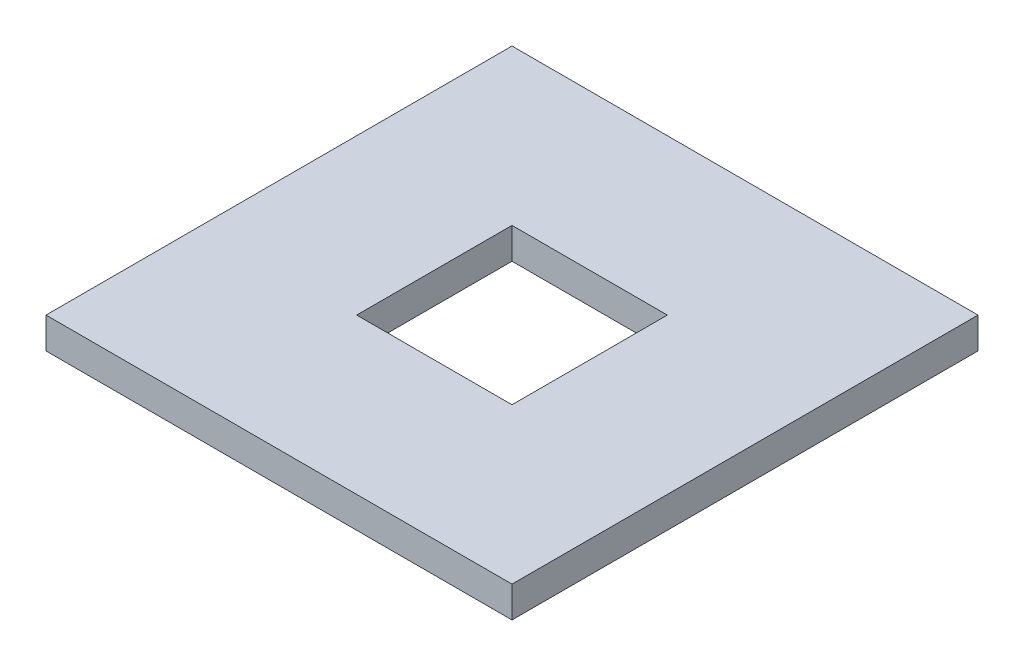
from build123d import *

# Parameters (mm, degrees)
SKETCH1_W           = 1500
SKETCH1_H           = 1500
SKETCH1_W_2         = 500
SKETCH1_H_2         = 500
BOSS_EXTRUDE1_DEPTH = 100


with BuildPart() as part:
    # Sketch1 → Boss-Extrude1 (new body)
    with BuildSketch(Plane(origin=(0, 0, 0), x_dir=(1, 0, 0), z_dir=(0, 1, 0))):
        with Locations((750, 750)):
            Rectangle(SKETCH1_W, SKETCH1_H)
        with Locations((750, 750)):
            Rectangle(SKETCH1_W_2, SKETCH1_H_2, mode=Mode.SUBTRACT)
    extrude(amount=BOSS_EXTRUDE1_DEPTH)


solid = part.part
